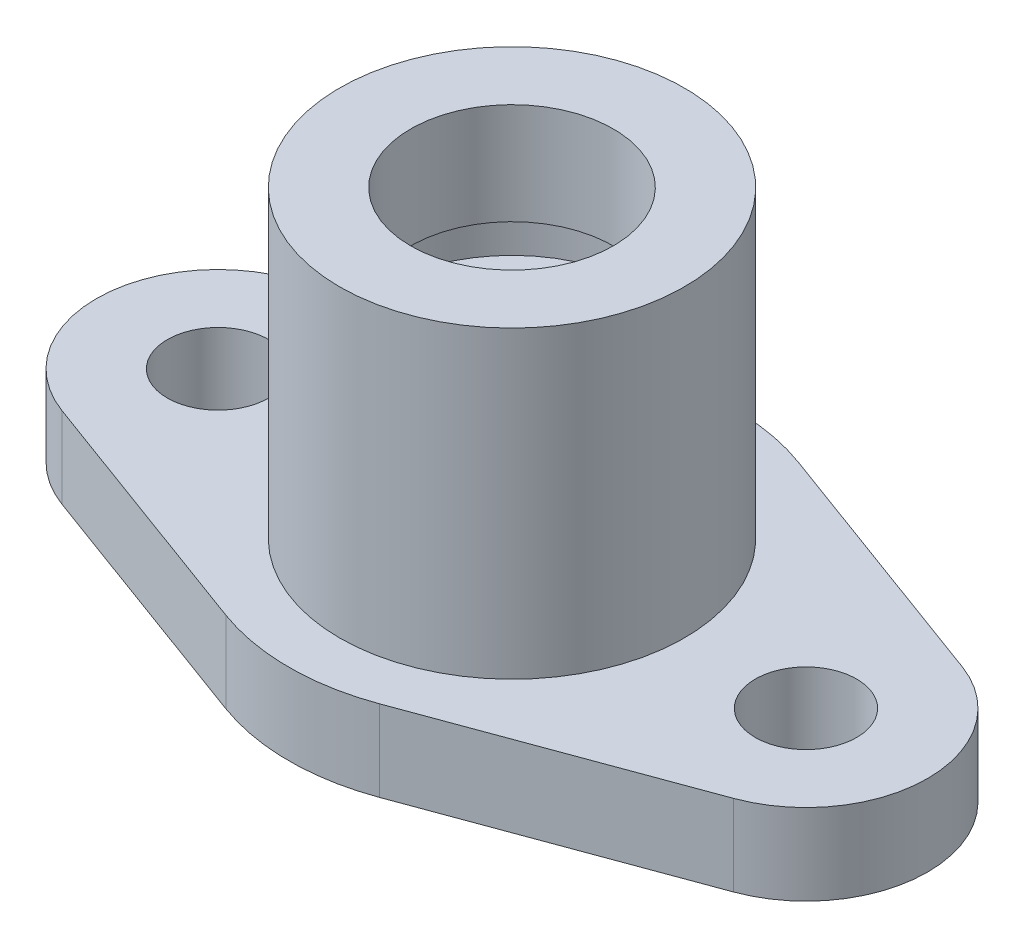
from build123d import *

# Parameters (mm, degrees)
SKETCH_1_R      = 5
SKETCH_1_R_2    = 22
SKETCH_1_R_3    = 17
SKETCH_1_R_4    = 10
EXTRUDE_1_DEPTH = 8
SKETCH_1_3_R    = 17
SKETCH_1_3_R_2  = 10
EXTRUDE_2_DEPTH = 38
SKETCH_2_W      = 13
SKETCH_2_H      = 5


with BuildPart() as part:
    # 草圖1 → 伸長1 (new body)
    # profile 1 of 4: a face of its own
    with BuildSketch(Plane(origin=(0, 0, 0), x_dir=(1, 0, 0), z_dir=(0, 1, 0))):
        with BuildLine():
            Line((33.137931034, 11.263992487), (7.586206897, 20.650652893))
            ThreePointArc((7.586206897, 20.650652893), (18.040185028, 12.591732372), (22, 0))
            ThreePointArc((22, 0), (18.040185028, -12.591732372), (7.586206897, -20.650652893))
            Line((7.586206897, -20.650652893), (33.137931034, -11.263992487))
            ThreePointArc((33.137931034, -11.263992487), (41, 0), (33.137931034, 11.263992487))
        make_face()
        with Locations(Location((29, 0, 0), (0, 0, 270))):
            Circle(SKETCH_1_R, mode=Mode.SUBTRACT)
    # profile 2 of 4: a face of its own
    with BuildSketch(Plane(origin=(0, 0, 0), x_dir=(1, 0, 0), z_dir=(0, 1, 0))):
        Circle(SKETCH_1_R_2)
        Circle(SKETCH_1_R_3, mode=Mode.SUBTRACT)
    # profile 3 of 4: a face of its own
    with BuildSketch(Plane(origin=(0, 0, 0), x_dir=(1, 0, 0), z_dir=(0, 1, 0))):
        Circle(SKETCH_1_R_3)
        with Locations(Location((0, 0, 0), (0, 0, 270))):
            Circle(SKETCH_1_R_4, mode=Mode.SUBTRACT)
    # profile 4 of 4: a face of its own
    with BuildSketch(Plane(origin=(0, 0, 0), x_dir=(1, 0, 0), z_dir=(0, 1, 0))):
        with BuildLine():
            ThreePointArc((-7.586206897, -20.650652893), (-22, 0), (-7.586206897, 20.650652893))
            Line((-7.586206897, 20.650652893), (-33.137931034, 11.263992487))
            ThreePointArc((-33.137931034, 11.263992487), (-41, 0), (-33.137931034, -11.263992487))
            Line((-33.137931034, -11.263992487), (-7.586206897, -20.650652893))
        make_face()
        with Locations(Location((-29, 0, 0), (0, 0, 270))):
            Circle(SKETCH_1_R, mode=Mode.SUBTRACT)
    extrude(amount=EXTRUDE_1_DEPTH)

    # 草圖1<3> → 伸長2 (add)
    with BuildSketch(Plane(origin=(0, 0, 0), x_dir=(1, 0, 0), z_dir=(0, 1, 0))):
        with Locations(Location((0, 0, 0), (0, 0, 270))):
            Circle(SKETCH_1_3_R)
        with Locations(Location((0, 0, 0), (0, 0, 270))):
            Circle(SKETCH_1_3_R_2, mode=Mode.SUBTRACT)
    extrude(amount=EXTRUDE_2_DEPTH)

    # 草圖2 → 除料-旋轉1 (revolve, cut)
    with BuildSketch(Plane.XY, mode=Mode.PRIVATE) as cut_revolve_1_sk:
        with Locations((6.5, 25.5)):
            Rectangle(SKETCH_2_W, SKETCH_2_H)
    revolve(cut_revolve_1_sk.sketch.rotate(Axis((0, 0, 0), (0, 1, 0)), 90), axis=Axis((0, 0, 0), (0, 1, 0)), mode=Mode.SUBTRACT)


solid = part.part
